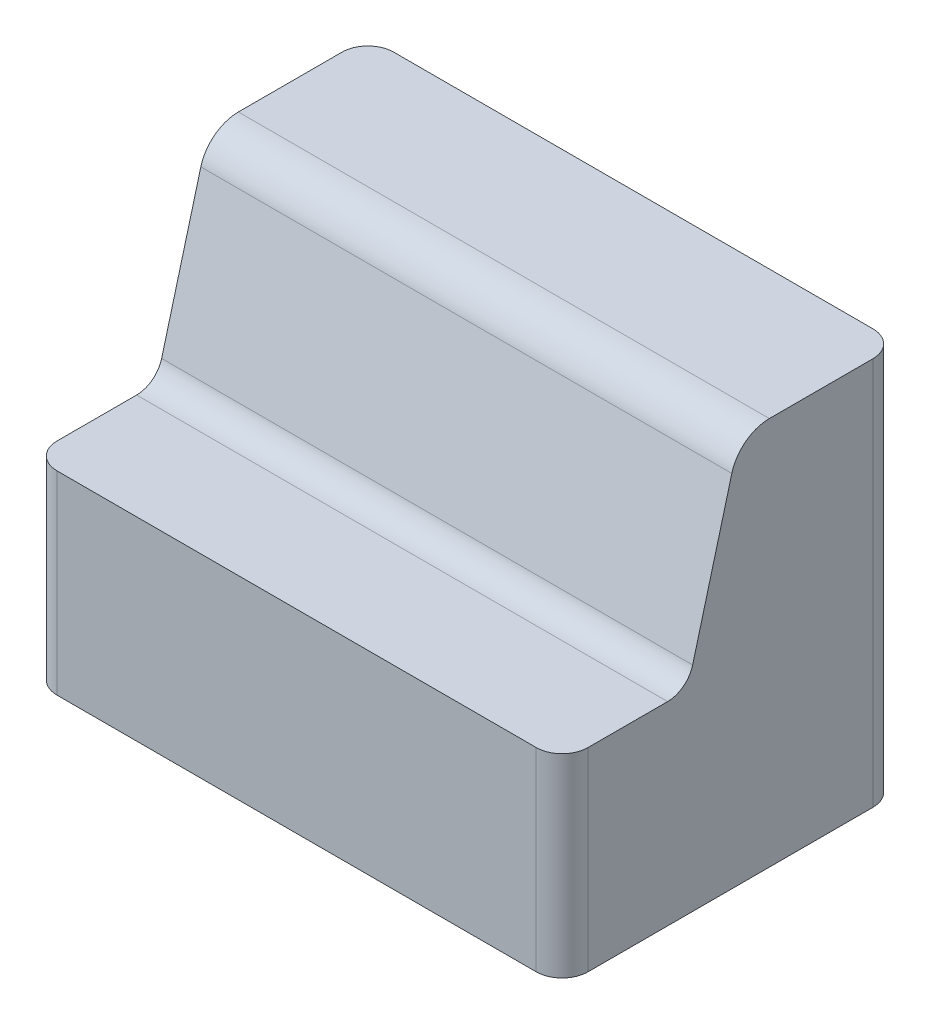
from build123d import *

# Parameters (mm, degrees)
BOSS_EXTRUDE1_DEPTH         = 20.5
FILLET1_R                   = 2
M6_TAPPED_HOLE1_D           = 5
M6_TAPPED_HOLE1_DEPTH       = 17
M6_TAPPED_HOLE1_CSINK_D     = 6.05
M6_TAPPED_HOLE1_CSINK_ANGLE = 90
M6_TAPPED_HOLE1_TIP         = 1.502151548
FILLET2_R                   = 2


with BuildPart() as part:
    # Sketch1 → Boss-Extrude1 (new, symmetric)
    with BuildSketch(Plane(origin=(0, 0, 0), x_dir=(0, 0, -1), z_dir=(1, 0, 0))):
        with BuildLine():
            Line((-10, 0), (0, 0))
            Line((0, 0), (0, -30))
            Line((0, -30), (-26, -30))
            Line((-26, -30), (-26, -15))
            Line((-26, -15), (-16.32121885, -15))
            Line((-16.32121885, -15), (-12.897777479, -2.223542865))
            ThreePointArc((-12.897777479, -2.223542865), (-11.826284287, -0.619939979), (-10, 0))
        make_face()
    extrude(amount=BOSS_EXTRUDE1_DEPTH, both=True)

    # Fillet1
    fillet1_edges = [part.edges().sort_by_distance(p)[0] for p in [
        (20.5, -22.5, 26),
        (20.5, -15, 0),
        (-20.5, -15, 0),
        (-20.5, -22.5, 26),
    ]]
    fillet(fillet1_edges, radius=FILLET1_R)

    # M6 Tapped Hole1
    with Locations(Plane(origin=(0, -30, 0), x_dir=(-1, 0, 0), z_dir=(0, -1, 0))):
        with Locations((-13, -7.5), (13, -7.5)):
            CounterSinkHole(M6_TAPPED_HOLE1_D / 2, M6_TAPPED_HOLE1_CSINK_D / 2, depth=M6_TAPPED_HOLE1_DEPTH, counter_sink_angle=M6_TAPPED_HOLE1_CSINK_ANGLE)
            with Locations((0, 0, -(M6_TAPPED_HOLE1_DEPTH + M6_TAPPED_HOLE1_TIP / 2))):  # 118° drill point
                Cone(0, M6_TAPPED_HOLE1_D / 2, M6_TAPPED_HOLE1_TIP, mode=Mode.SUBTRACT)

    # Fillet2
    fillet2_edges = [part.edges().sort_by_distance(p)[0] for p in [
        (0, -15, 16.32121885),
    ]]
    fillet(fillet2_edges, radius=FILLET2_R)


solid = part.part
